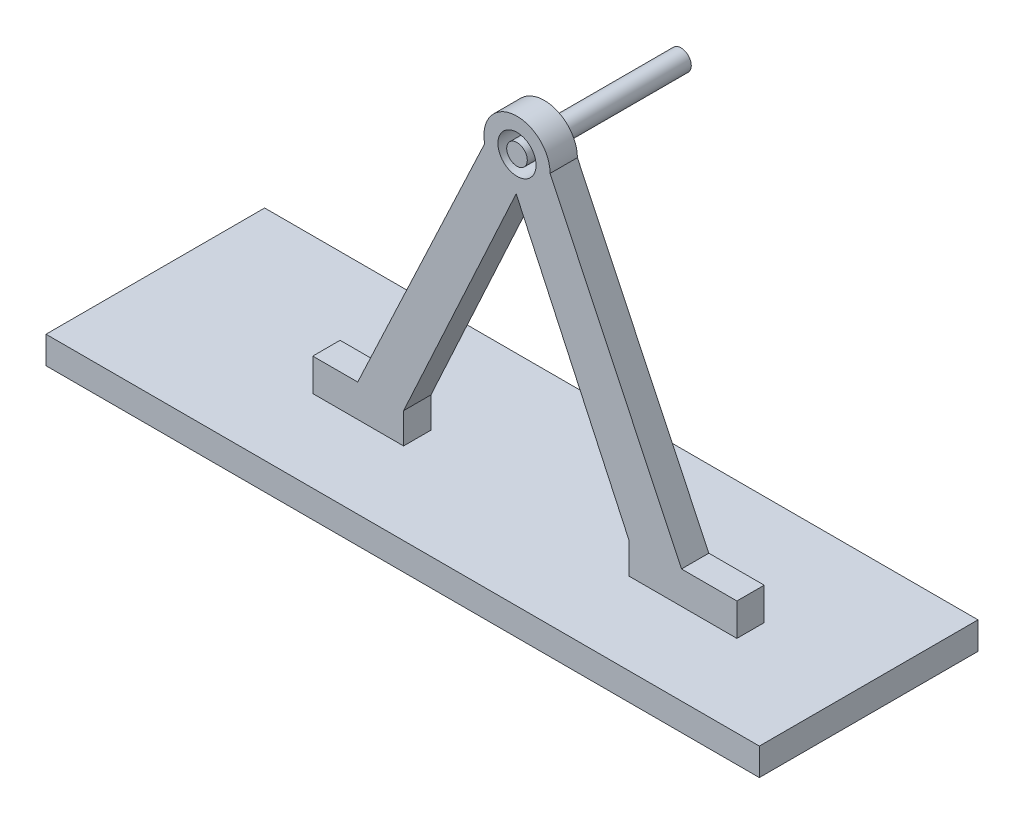
from build123d import *

# Parameters (mm, degrees)
SKETCH3_W           = 132.588
SKETCH3_H           = 40.64
BOSS_EXTRUDE2_DEPTH = 5.08
SKETCH4_R           = 3.54179385
BOSS_EXTRUDE3_DEPTH = 5.08
CUT_EXTRUDE1_DEPTH  = 5.08
SKETCH6_R           = 1.915721575
BOSS_EXTRUDE4_DEPTH = 30.48


with BuildPart() as part:
    # Sketch3 → Boss-Extrude2 (new body)
    with BuildSketch(Plane(origin=(0, 0, 0), x_dir=(1, 0, 0), z_dir=(0, 1, 0))):
        with Locations((66.294, 20.32)):
            Rectangle(SKETCH3_W, SKETCH3_H)
    extrude(amount=BOSS_EXTRUDE2_DEPTH)

    # Sketch4 → Boss-Extrude3 (add)
    with BuildSketch(Plane.XY.offset(-20.32)):
        with BuildLine():
            Line((42.695281609, 5.08), (34.340990791, 5.08))
            Line((34.340990791, 5.08), (34.340990791, 11.109607591))
            Line((34.340990791, 11.109607591), (42.695281609, 11.109607591))
            Line((42.695281609, 11.109607591), (66.294, 61.264635576))
            ThreePointArc((66.294, 61.264635576), (71.649082672, 68.674805636), (78.448554806, 62.562955717))
            Line((78.448554806, 62.562955717), (102.880626177, 11.109607591))
            Line((102.880626177, 11.109607591), (113.174490492, 11.109607591))
            Line((113.174490492, 11.109607591), (113.174490492, 5.08))
            Line((113.174490492, 5.08), (42.695281609, 5.08))
        make_face()
        with Locations((72.301935695, 62.562955717)):
            Circle(SKETCH4_R, mode=Mode.SUBTRACT)
    extrude(amount=BOSS_EXTRUDE3_DEPTH)

    # Sketch5 → Cut-Extrude1 (cut)
    with BuildSketch(Plane.XY.offset(-15.24)):
        Polygon((72.150616243, 56.147034971), (51.221825845, 10.758259087), (51.221825845, 5.08), (93.165533351, 5.08), (93.165533351, 10.758259087), align=None)
    extrude(amount=-CUT_EXTRUDE1_DEPTH, mode=Mode.SUBTRACT)


with BuildPart() as body_2:
    # Sketch6 → Boss-Extrude4 (new body)
    with BuildSketch(Plane.XY.offset(-15.24)):
        with Locations((72.301935695, 62.562955717)):
            Circle(SKETCH6_R)
    extrude(amount=-BOSS_EXTRUDE4_DEPTH)


solid = Compound([part.part, body_2.part])
